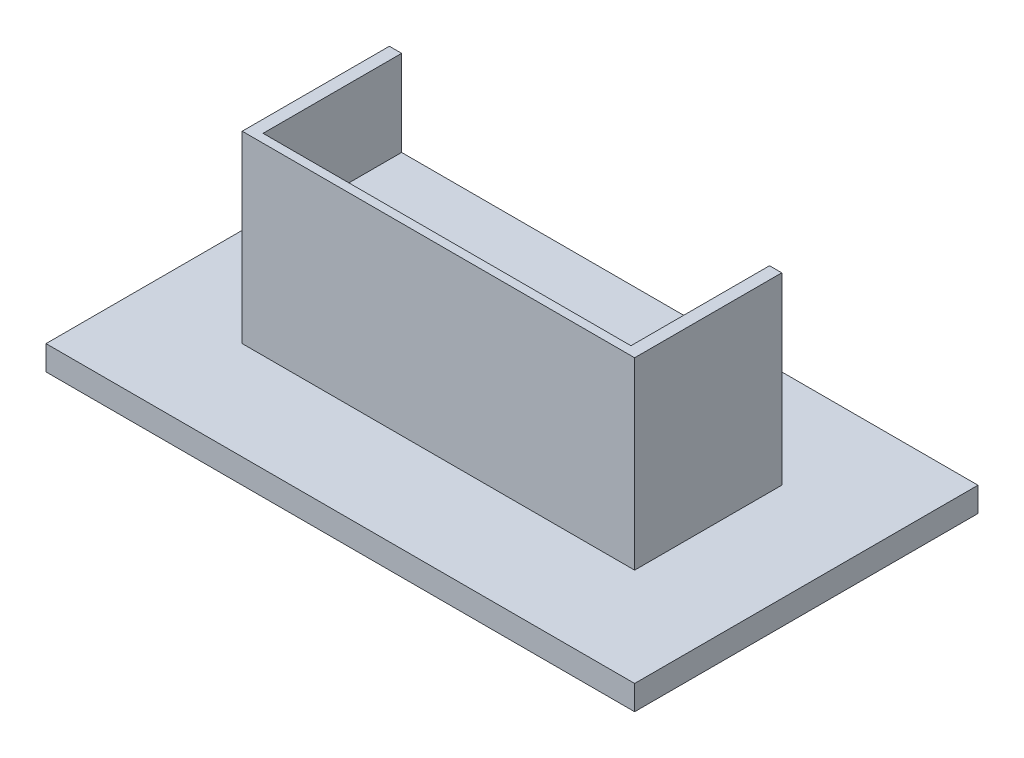
from build123d import *

# Parameters (mm, degrees)
BOSS_EXTRUDE1_DEPTH      = 70000
BOSS_EXTRUDE1_DEPTH_BACK = 70000
SKETCH1_W                = 240000
SKETCH1_H                = 10000
SKETCH2_W                = 160000
SKETCH2_H                = 60000
BOSS_EXTRUDE2_DEPTH      = 40000
SKETCH3_W                = 160000
SKETCH3_H                = 3500
BOSS_EXTRUDE3_DEPTH      = 35000
SKETCH4_W                = 5000
SKETCH4_H                = 56500
BOSS_EXTRUDE4_DEPTH      = 35000


with BuildPart() as part:
    # Sketch1 → Boss-Extrude1 (new, two sides: drawn at the far end of the back side and taken through both)
    with BuildSketch(Plane.XY.offset(-BOSS_EXTRUDE1_DEPTH_BACK)):
        Rectangle(SKETCH1_W, SKETCH1_H)
    extrude(amount=BOSS_EXTRUDE1_DEPTH + BOSS_EXTRUDE1_DEPTH_BACK)

    # Sketch2 → Boss-Extrude2 (add)
    with BuildSketch(Plane(origin=(0, 5000, 0), x_dir=(1, 0, 0), z_dir=(0, 1, 0))):
        Rectangle(SKETCH2_W, SKETCH2_H)
    extrude(amount=BOSS_EXTRUDE2_DEPTH)

    # Sketch3 → Boss-Extrude3 (add)
    with BuildSketch(Plane(origin=(0, 45000, 0), x_dir=(1, 0, 0), z_dir=(0, 1, 0))):
        with Locations((0, -28250)):
            Rectangle(SKETCH3_W, SKETCH3_H)
    extrude(amount=BOSS_EXTRUDE3_DEPTH)

    # Sketch4 → Boss-Extrude4 (add)
    with BuildSketch(Plane(origin=(0, 45000, 0), x_dir=(1, 0, 0), z_dir=(0, 1, 0))):
        with Locations((-77500, 1750)):
            Rectangle(SKETCH4_W, SKETCH4_H)
        with Locations((77500, 1750)):
            Rectangle(SKETCH4_W, SKETCH4_H)
    extrude(amount=BOSS_EXTRUDE4_DEPTH)


solid = part.part
